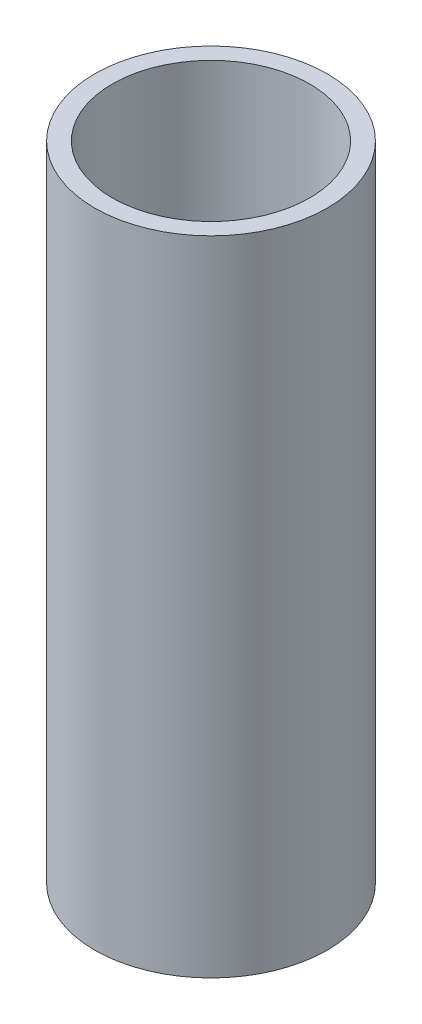
from build123d import *

# Parameters (mm, degrees)
SKETCH1_R           = 19.9
BOSS_EXTRUDE1_DEPTH = 55
SKETCH2_R           = 16.9
CUT_EXTRUDE1_DEPTH  = 123


with BuildPart() as part:
    # Sketch1 → Boss-Extrude1 (new, symmetric)
    with BuildSketch(Plane(origin=(0, 0, 0), x_dir=(1, 0, 0), z_dir=(0, 1, 0))):
        with Locations(Location((0, 0, 0), (0, 0, 270))):
            Circle(SKETCH1_R)
    extrude(amount=BOSS_EXTRUDE1_DEPTH, both=True)

    # Sketch2 → Cut-Extrude1 (cut)
    with BuildSketch(Plane(origin=(0, 55, 0), x_dir=(1, 0, 0), z_dir=(0, 1, 0))):
        with Locations(Location((0, 0, 0), (0, 0, 270))):
            Circle(SKETCH2_R)
    extrude(amount=-CUT_EXTRUDE1_DEPTH, mode=Mode.SUBTRACT)


solid = part.part
